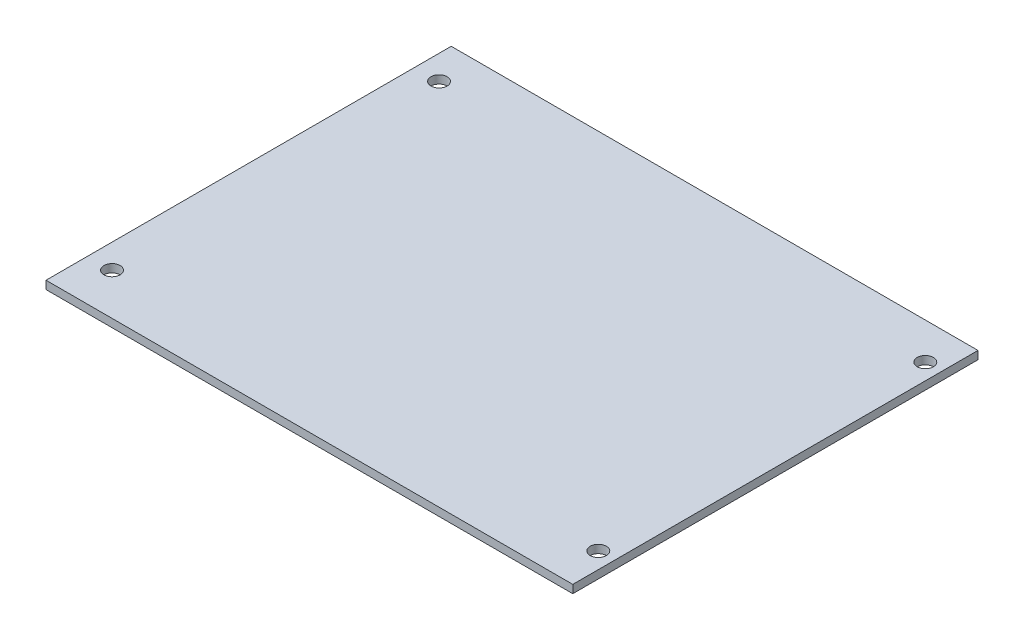
from build123d import *

# Parameters (mm, degrees)
SKETCH1_W           = 130
SKETCH1_H           = 100
SKETCH1_R           = 2
BOSS_EXTRUDE1_DEPTH = 2


with BuildPart() as part:
    # Sketch1 → Boss-Extrude1 (new body)
    with BuildSketch(Plane(origin=(0, 0, 0), x_dir=(1, 0, 0), z_dir=(0, 1, 0))):
        with Locations((65, 50)):
            Rectangle(SKETCH1_W, SKETCH1_H)
        with Locations(Location((6, 10.3, 0), (0, 0, 270))):
            Circle(SKETCH1_R, mode=Mode.SUBTRACT)
        with Locations(Location((126, 10.3, 0), (0, 0, 270))):
            Circle(SKETCH1_R, mode=Mode.SUBTRACT)
        with Locations(Location((126, 91, 0), (0, 0, 270))):
            Circle(SKETCH1_R, mode=Mode.SUBTRACT)
        with Locations(Location((6, 91, 0), (0, 0, 270))):
            Circle(SKETCH1_R, mode=Mode.SUBTRACT)
    extrude(amount=BOSS_EXTRUDE1_DEPTH)


solid = part.part
